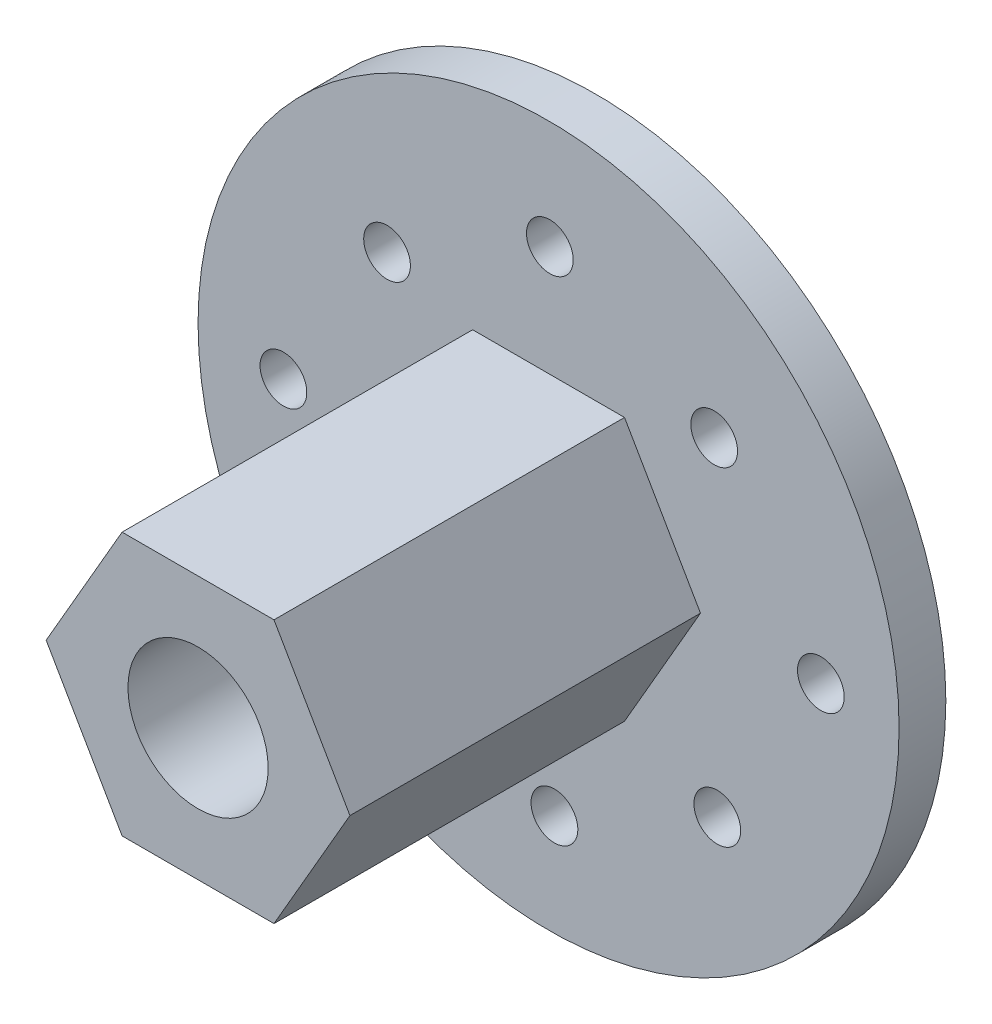
from build123d import *
from build123d.topology import SkipClean

# Parameters (mm, degrees)
SKETCH_1_R      = 3
EXTRUDE_1_DEPTH = 15
EXTRUDE_START   = 2
SKETCH_2_R      = 15
SKETCH_2_R_2    = 3
SKETCH_2_R_3    = 1
EXTRUDE_2_DEPTH = 2


with BuildPart() as part:
    # 草图1 → 凸台-拉伸1 (new body)
    with BuildSketch(Plane.XY):
        Polygon((-3.25, -5.629165125), (3.25, -5.629165125), (6.5, 0), (3.25, 5.629165125), (-3.25, 5.629165125), (-6.5, 0), align=None)
        Circle(SKETCH_1_R, mode=Mode.SUBTRACT)
    extrude(amount=EXTRUDE_1_DEPTH)

    # 草图2 → 凸台-拉伸2 (add)
    with SkipClean():  # the faces are left unmerged after this step: merging them gives an invalid solid
        with BuildSketch(Plane(origin=(0, 0, 0), x_dir=(-1, 0, 0), z_dir=(0, 0, -1)).offset(EXTRUDE_START)):
            Circle(SKETCH_2_R)
            Circle(SKETCH_2_R_2, mode=Mode.SUBTRACT)
            with Locations((-0.054658846, 10.360319416)):
                Circle(SKETCH_2_R_3, mode=Mode.SUBTRACT)
            with Locations((6.912201484, 6.667909711)):
                Circle(SKETCH_2_R_3, mode=Mode.SUBTRACT)
            with Locations((11.346782596, -0.246606579)):
                Circle(SKETCH_2_R_3, mode=Mode.SUBTRACT)
            with Locations((6.779857889, -7.331892684)):
                Circle(SKETCH_2_R_3, mode=Mode.SUBTRACT)
            with Locations((-0.25051923, -10.6387672)):
                Circle(SKETCH_2_R_3, mode=Mode.SUBTRACT)
            with Locations((-7.220104111, -7.200993699)):
                Circle(SKETCH_2_R_3, mode=Mode.SUBTRACT)
            with Locations((-11.652217031, -0.032092826)):
                Circle(SKETCH_2_R_3, mode=Mode.SUBTRACT)
            with Locations((-7.087024538, 6.795828302)):
                Circle(SKETCH_2_R_3, mode=Mode.SUBTRACT)
        extrude(amount=-EXTRUDE_2_DEPTH)


solid = part.part
